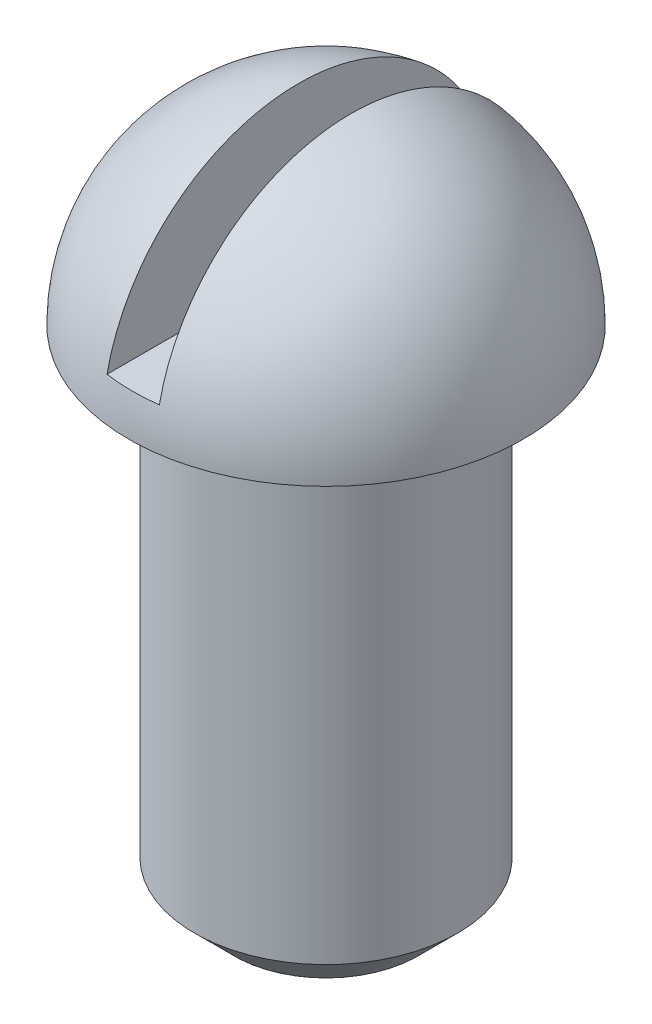
from build123d import *

# Parameters (mm, degrees)
CUT_EXTRUDE1_DEPTH      = 58.087651905
CUT_EXTRUDE1_DEPTH_BACK = 58.087651905
SKETCH2_W               = 4
SKETCH2_H               = 13.48877178


with BuildPart() as part:
    # Sketch1 → Revolve1 (revolve)
    with BuildSketch(Plane.XY, mode=Mode.PRIVATE) as revolve1_sk:
        with BuildLine():
            Line((0, 0), (0, 38))
            Line((0, 38), (0, 53))
            ThreePointArc((0, 53), (-10.606601718, 48.606601718), (-15, 38))
            Line((-15, 38), (-10, 38))
            Line((-10, 38), (-10, 3))
            Line((-10, 3), (-7, 0))
            Line((-7, 0), (0, 0))
        make_face()
    revolve(revolve1_sk.sketch.rotate(Axis((0, 0, 0), (0, 1, 0)), 270), axis=Axis((0, 0, 0), (0, 1, 0)))

    # Sketch2 → Cut-Extrude1 (cut, two sides: drawn at the far end of the back side and taken through both)
    with BuildSketch(Plane.XY.offset(-CUT_EXTRUDE1_DEPTH_BACK)):
        with Locations((-0.088381083, 47.743522134)):
            Rectangle(SKETCH2_W, SKETCH2_H)
    extrude(amount=CUT_EXTRUDE1_DEPTH + CUT_EXTRUDE1_DEPTH_BACK, mode=Mode.SUBTRACT)


solid = part.part
